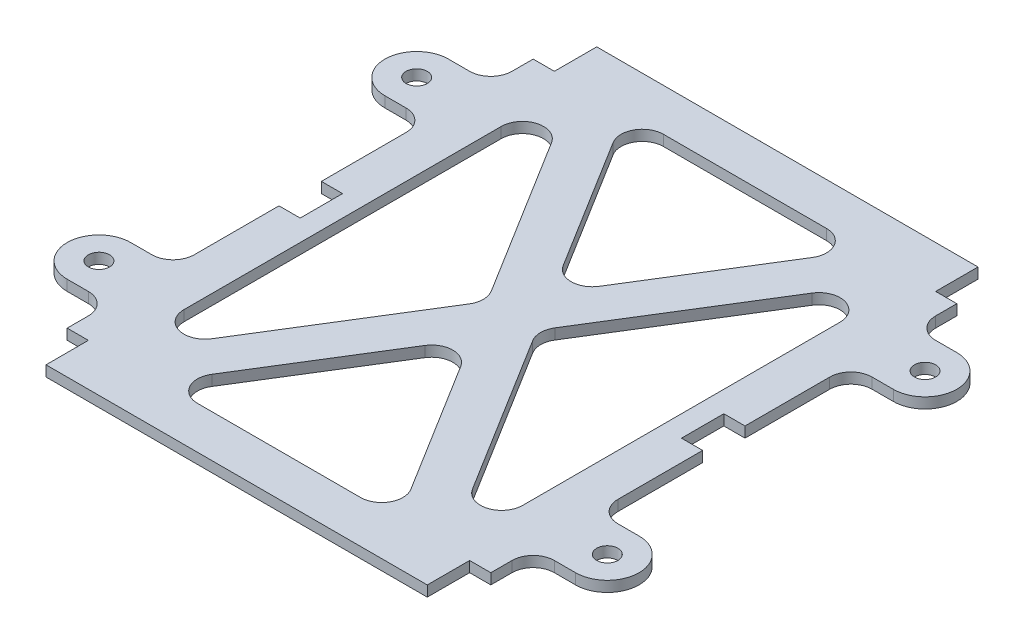
from build123d import *

# Parameters (mm, degrees)
SKETCH1_R           = 3.175
BOSS_EXTRUDE1_DEPTH = 3.175


with BuildPart() as part:
    # Sketch1 → Boss-Extrude1 (new body)
    with BuildSketch(Plane(origin=(0, 0, 0), x_dir=(1, 0, 0), z_dir=(0, 1, 0))):
        with BuildLine():
            Line((0, 161.169349013), (114.3, 161.169349013))
            Line((114.3, 161.169349013), (114.3, 148.469349013))
            Line((114.3, 148.469349013), (120.65, 148.469349013))
            Line((120.65, 148.469349013), (120.65, 142.119349013))
            ThreePointArc((120.65, 142.119349013), (122.509871939, 137.629220953), (127, 135.769349013))
            Line((127, 135.769349013), (133.35, 135.769349013))
            ThreePointArc((133.35, 135.769349013), (142.875, 126.244349013), (133.35, 116.719349013))
            Line((133.35, 116.719349013), (127, 116.719349013))
            ThreePointArc((127, 116.719349013), (122.509871939, 114.859477074), (120.65, 110.369349013))
            Line((120.65, 110.369349013), (120.65, 84.969349013))
            Line((120.65, 84.969349013), (114.3, 84.969349013))
            Line((114.3, 84.969349013), (114.3, 72.269349013))
            Line((114.3, 72.269349013), (120.65, 72.269349013))
            Line((120.65, 72.269349013), (120.65, 46.869349013))
            ThreePointArc((120.65, 46.869349013), (122.509871939, 42.379220953), (127, 40.519349013))
            Line((127, 40.519349013), (133.35, 40.519349013))
            ThreePointArc((133.35, 40.519349013), (142.875, 30.994349013), (133.35, 21.469349013))
            Line((133.35, 21.469349013), (127, 21.469349013))
            ThreePointArc((127, 21.469349013), (122.509871939, 19.609477074), (120.65, 15.119349013))
            Line((120.65, 15.119349013), (120.65, 8.769349013))
            Line((120.65, 8.769349013), (114.3, 8.769349013))
            Line((114.3, 8.769349013), (114.3, -3.930650987))
            Line((114.3, -3.930650987), (0, -3.930650987))
            Line((0, -3.930650987), (0, 8.769349013))
            Line((0, 8.769349013), (-6.35, 8.769349013))
            Line((-6.35, 8.769349013), (-6.35, 15.119349013))
            ThreePointArc((-6.35, 15.119349013), (-8.209871939, 19.609477074), (-12.7, 21.469349013))
            Line((-12.7, 21.469349013), (-19.05, 21.469349013))
            ThreePointArc((-19.05, 21.469349013), (-28.575, 30.994349013), (-19.05, 40.519349013))
            Line((-19.05, 40.519349013), (-12.7, 40.519349013))
            ThreePointArc((-12.7, 40.519349013), (-8.209871939, 42.379220953), (-6.35, 46.869349013))
            Line((-6.35, 46.869349013), (-6.35, 72.269349013))
            Line((-6.35, 72.269349013), (0, 72.269349013))
            Line((0, 72.269349013), (0, 84.969349013))
            Line((0, 84.969349013), (-6.35, 84.969349013))
            Line((-6.35, 84.969349013), (-6.35, 110.369349013))
            ThreePointArc((-6.35, 110.369349013), (-8.209871939, 114.859477074), (-12.7, 116.719349013))
            Line((-12.7, 116.719349013), (-19.05, 116.719349013))
            ThreePointArc((-19.05, 116.719349013), (-28.575, 126.244349013), (-19.05, 135.769349013))
            Line((-19.05, 135.769349013), (-12.7, 135.769349013))
            ThreePointArc((-12.7, 135.769349013), (-8.209871939, 137.629220953), (-6.35, 142.119349013))
            Line((-6.35, 142.119349013), (-6.35, 148.469349013))
            Line((-6.35, 148.469349013), (0, 148.469349013))
            Line((0, 148.469349013), (0, 161.169349013))
        make_face()
        with Locations(Location((-19.05, 126.244349013, 0), (0, 0, 270))):
            Circle(SKETCH1_R, mode=Mode.SUBTRACT)
        with Locations(Location((-19.05, 30.994349013, 0), (0, 0, 270))):
            Circle(SKETCH1_R, mode=Mode.SUBTRACT)
        with Locations(Location((133.35, 30.994349013, 0), (0, 0, 270))):
            Circle(SKETCH1_R, mode=Mode.SUBTRACT)
        with Locations(Location((133.35, 126.244349013, 0), (0, 0, 270))):
            Circle(SKETCH1_R, mode=Mode.SUBTRACT)
        with BuildLine():
            Line((107.95, 126.185693187), (107.95, 31.05300484))
            ThreePointArc((107.95, 31.05300484), (103.340232575, 24.946116059), (96.203829737, 27.705790103))
            Line((96.203829737, 27.705790103), (66.698688048, 75.272134277))
            ThreePointArc((66.698688048, 75.272134277), (65.744858311, 78.619349013), (66.698688048, 81.96656375))
            Line((66.698688048, 81.96656375), (96.203829737, 129.532907923))
            ThreePointArc((96.203829737, 129.532907923), (103.340232575, 132.292581968), (107.95, 126.185693187))
        make_face(mode=Mode.SUBTRACT)
        with BuildLine():
            Line((81.593842457, 8.769349013), (32.706157543, 8.769349013))
            ThreePointArc((32.706157543, 8.769349013), (27.157404819, 12.031656799), (27.30998728, 18.46656375))
            Line((27.30998728, 18.46656375), (51.753829737, 57.873397836))
            ThreePointArc((51.753829737, 57.873397836), (57.15, 60.876183099), (62.546170263, 57.873397836))
            Line((62.546170263, 57.873397836), (86.99001272, 18.46656375))
            ThreePointArc((86.99001272, 18.46656375), (87.142595181, 12.031656799), (81.593842457, 8.769349013))
        make_face(mode=Mode.SUBTRACT)
        with BuildLine():
            Line((6.35, 126.185693187), (6.35, 31.05300484))
            ThreePointArc((6.35, 31.05300484), (10.959767425, 24.946116059), (18.096170263, 27.705790103))
            Line((18.096170263, 27.705790103), (47.601311952, 75.272134277))
            ThreePointArc((47.601311952, 75.272134277), (48.555141689, 78.619349013), (47.601311952, 81.96656375))
            Line((47.601311952, 81.96656375), (18.096170263, 129.532907923))
            ThreePointArc((18.096170263, 129.532907923), (10.959767425, 132.292581968), (6.35, 126.185693187))
        make_face(mode=Mode.SUBTRACT)
        with BuildLine():
            Line((86.99001272, 138.772134277), (62.546170263, 99.36530019))
            ThreePointArc((62.546170263, 99.36530019), (57.15, 96.362514927), (51.753829737, 99.36530019))
            Line((51.753829737, 99.36530019), (27.30998728, 138.772134277))
            ThreePointArc((27.30998728, 138.772134277), (27.157404819, 145.207041228), (32.706157543, 148.469349013))
            Line((32.706157543, 148.469349013), (81.593842457, 148.469349013))
            ThreePointArc((81.593842457, 148.469349013), (87.142595181, 145.207041228), (86.99001272, 138.772134277))
        make_face(mode=Mode.SUBTRACT)
    extrude(amount=BOSS_EXTRUDE1_DEPTH)


solid = part.part
